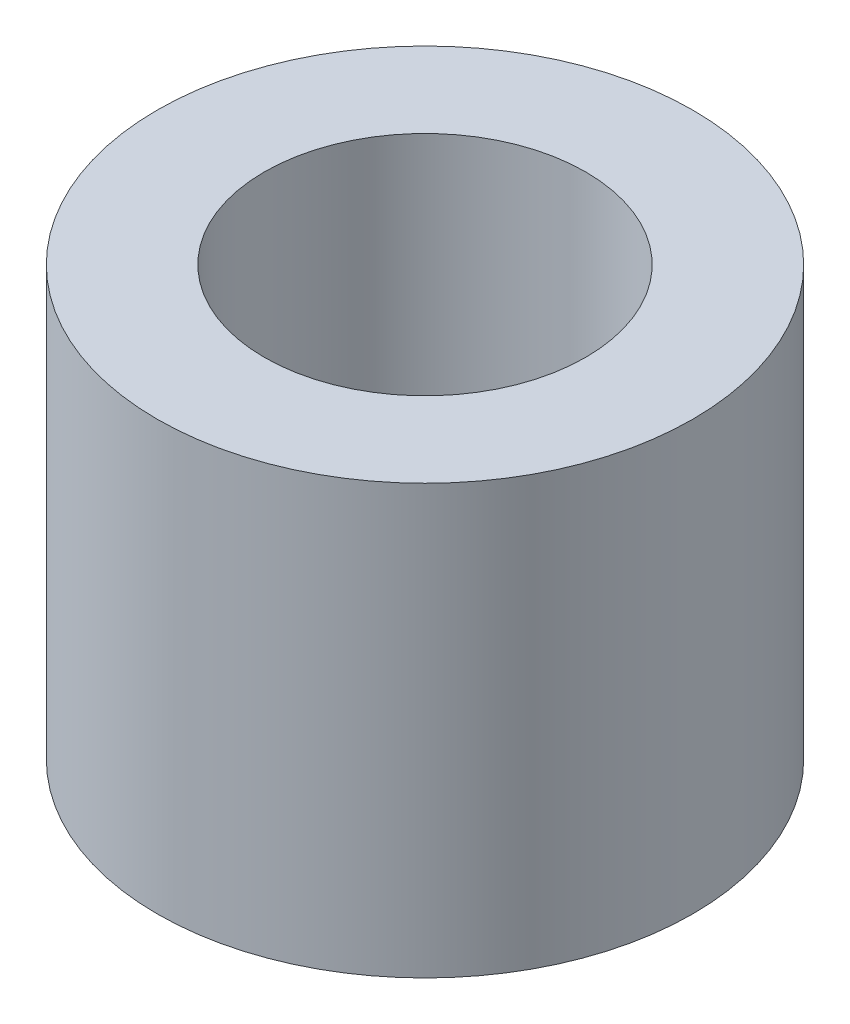
from build123d import *

# Parameters (mm, degrees)
SKETCH_1_R      = 2.5
SKETCH_1_R_2    = 1.5
EXTRUDE_1_DEPTH = 4


with BuildPart() as part:
    # Эскиз1 → Бобышка-Вытянуть1 (new body)
    with BuildSketch(Plane(origin=(0, 0, 0), x_dir=(1, 0, 0), z_dir=(0, 1, 0))):
        with Locations(Location((0, 0, 0), (0, 0, 270))):
            Circle(SKETCH_1_R)
        with Locations(Location((0, 0, 0), (0, 0, 270))):
            Circle(SKETCH_1_R_2, mode=Mode.SUBTRACT)
    extrude(amount=EXTRUDE_1_DEPTH)


solid = part.part
